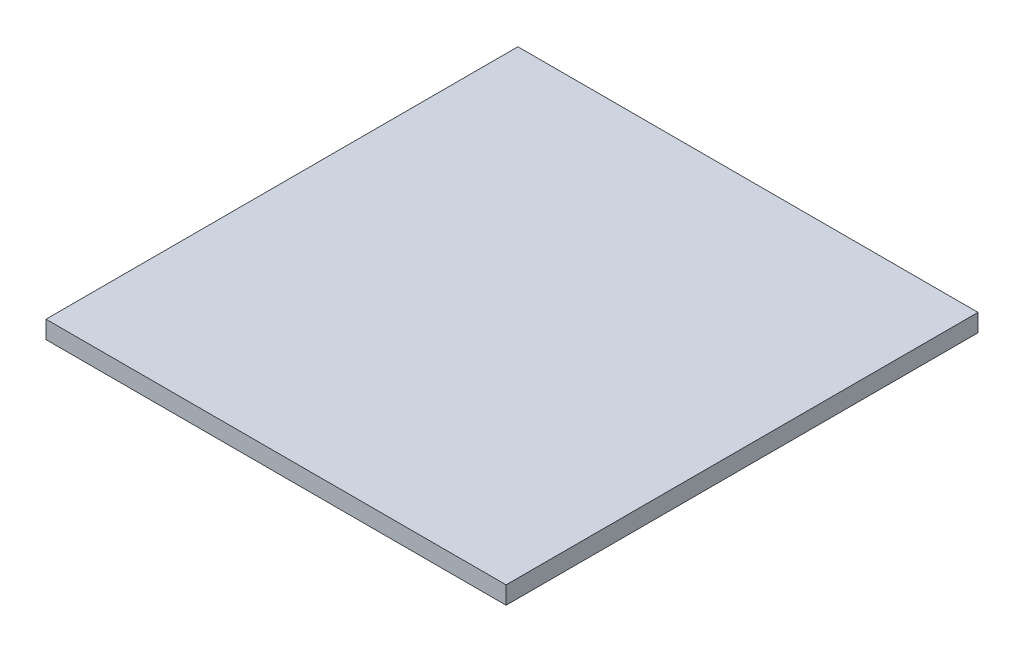
from build123d import *

# Parameters (mm, degrees)
SKETCH1_W           = 495.3
SKETCH1_H           = 508
BOSS_EXTRUDE1_DEPTH = 19.05


with BuildPart() as part:
    # Sketch1 → Boss-Extrude1 (new body)
    with BuildSketch(Plane(origin=(0, 0, 0), x_dir=(1, 0, 0), z_dir=(0, 1, 0))):
        Rectangle(SKETCH1_W, SKETCH1_H)
    extrude(amount=BOSS_EXTRUDE1_DEPTH)


solid = part.part
